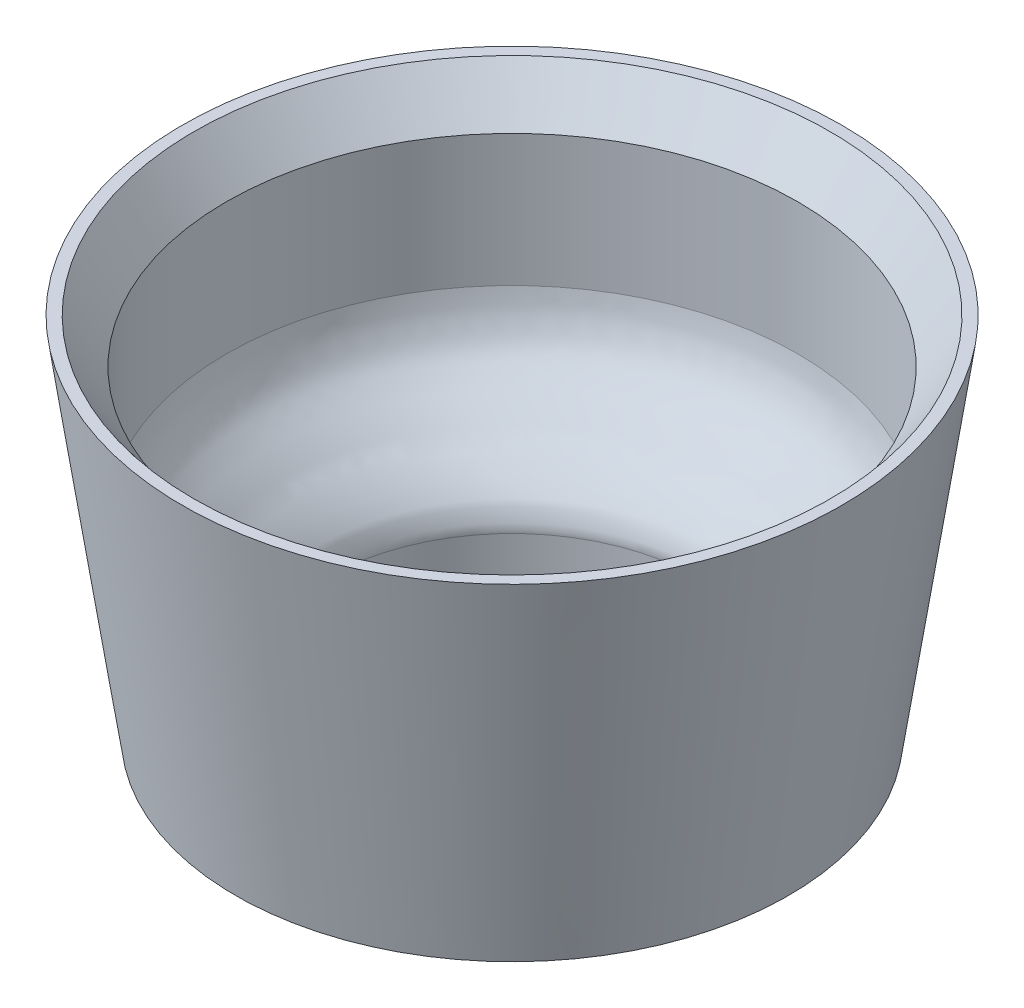
from build123d import *


with BuildPart() as part:
    # Sketch2 → Revolve6 (revolve)
    with BuildSketch(Plane(origin=(0, 0, 0), x_dir=(0, 0, -1), z_dir=(1, 0, 0))):
        with BuildLine():
            Line((26.5077562, 274.996982717), (26.5077562, 268.848618941))
            Line((26.5077562, 268.848618941), (39.220771913, 268.848618941))
            Line((39.220771913, 268.848618941), (46.76480408, 320.561079728))
            Line((46.76480408, 320.561079728), (44.197949192, 320.561079728))
            Line((44.197949192, 320.561079728), (40.547674755, 314.238618941))
            Line((40.547674755, 314.238618941), (40.547674755, 295.540718442))
            add(Edge.make_bspline(
                [(40.547674755, 295.540718442), (40.447740466, 295.01270962), (40.292777353, 293.970757622), (39.930889756, 292.587532756), (39.516186417, 291.581451362), (39.108370784, 290.578047283), (38.439698056, 289.316986821), (37.331416088, 288.032583081), (36.368363883, 287.115418475), (35.630231266, 286.340079674), (35.016472728, 285.762737127), (34.394259797, 285.247169225), (33.635524663, 284.556558001), (32.920361335, 283.771384039), (32.129651902, 282.986073937), (31.485241785, 282.459482324), (30.914997209, 281.963476574), (30.371700347, 281.39129816), (29.78279616, 280.804626851), (29.227584582, 280.262154529), (28.724752619, 279.674853682), (28.180386254, 279.039651716), (27.651838316, 278.470209992), (27.308145936, 277.876839187), (26.995230081, 277.127164256), (26.597952618, 276.164510632), (26.464811583, 275.470548141), (26.5077562, 274.996982717)],
                knots=[0, 0, 0, 0, 0.062544048, 0.125088096, 0.156360121, 0.187632145, 0.250176193, 0.312720241, 0.375264289, 0.406536313, 0.437808337, 0.469080362, 0.500352386, 0.562896434, 0.594168458, 0.625440482, 0.656712506, 0.68798453, 0.719256554, 0.750528579, 0.781800603, 0.813072627, 0.844344651, 0.875616675, 0.906888699, 0.938160723, 1.000704771, 1.000704771, 1.000704771, 1.000704771], degree=3))
        make_face()
    revolve(axis=Axis((0, 0, 0), (0, 1, 0)))

    # Sketch3 → Cut-Revolve1 (revolve, cut)
    with BuildSketch(Plane(origin=(0, 0, 0), x_dir=(0, 0, -1), z_dir=(1, 0, 0)), mode=Mode.PRIVATE) as cut_revolve1_sk:
        Polygon((40.547674755, 314.238618941), (54.812040554, 333.871834134), (54.812040554, 347.836976562), (0, 347.836976562), (0, 311.675114189), (40.547674755, 311.675114189), align=None)
    revolve(cut_revolve1_sk.sketch.rotate(Axis((0, 347.836976562, 0), (0, -1, 0)), 180), axis=Axis((0, 347.836976562, 0), (0, -1, 0)), mode=Mode.SUBTRACT)


solid = part.part
